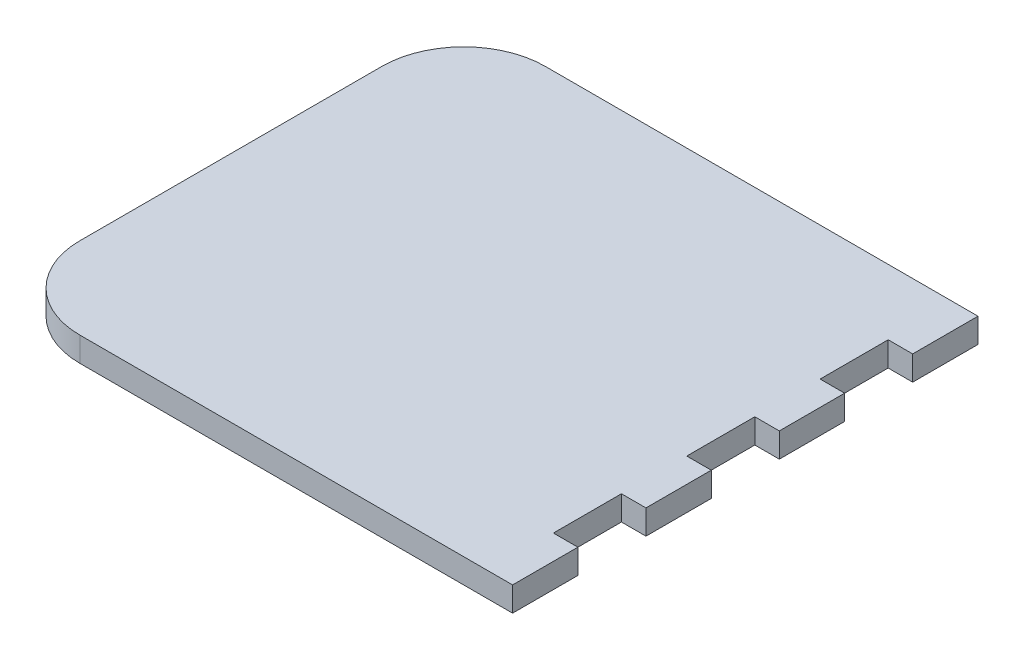
from build123d import *

# Parameters (mm, degrees)
ESQUISSE1_W             = 63
ESQUISSE1_H             = 57
BOSS_EXTRU_1_DEPTH      = 3
ESQUISSE2_W             = 3
ESQUISSE2_H             = 8.333333333
ESQUISSE2_H_2           = 8.333333334
ENL_V_MAT_EXTRU_1_DEPTH = 3
CONG_1_R                = 10


with BuildPart() as part:
    # Esquisse1 → Boss.-Extru.1 (new body)
    with BuildSketch(Plane(origin=(0, 0, 0), x_dir=(1, 0, 0), z_dir=(0, 1, 0))):
        with Locations((-31.5, 28.5)):
            Rectangle(ESQUISSE1_W, ESQUISSE1_H)
    extrude(amount=BOSS_EXTRU_1_DEPTH)

    # Esquisse2 → Enlèv. mat.-Extru.1 (cut)
    with BuildSketch(Plane(origin=(0, 3, 0), x_dir=(1, 0, 0), z_dir=(0, 1, 0))):
        with Locations((-1.5, 12.166666667)):
            Rectangle(ESQUISSE2_W, ESQUISSE2_H)
        with Locations((-1.5, 28.5)):
            Rectangle(ESQUISSE2_W, ESQUISSE2_H_2)
        with Locations((-1.5, 44.833333334)):
            Rectangle(ESQUISSE2_W, ESQUISSE2_H)
    extrude(amount=-ENL_V_MAT_EXTRU_1_DEPTH, mode=Mode.SUBTRACT)

    # Congé1
    cong_1_edges = [part.edges().sort_by_distance(p)[0] for p in [
        (-63, 1.5, 0),
        (-63, 1.5, -57),
    ]]
    fillet(cong_1_edges, radius=CONG_1_R)


solid = part.part
